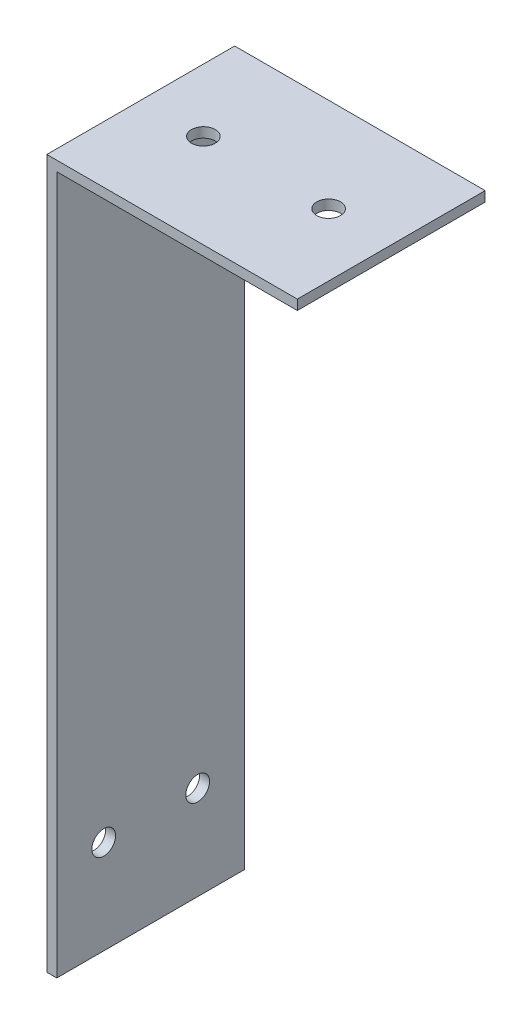
from build123d import *

# Parameters (mm, degrees)
BOSS_EXTRUDE1_DEPTH   = 15
F_6_CLEARANCE_HOLE1_D = 3.7973
F_6_CLEARANCE_HOLE2_D = 3.7973


with BuildPart() as part:
    # Sketch1 → Boss-Extrude1 (new, symmetric)
    with BuildSketch(Plane.XY):
        Polygon((0, 0), (0, 113.1), (40, 113.1), (40, 111.5125), (1.5875, 111.5125), (1.5875, 0), align=None)
    extrude(amount=BOSS_EXTRUDE1_DEPTH, both=True)

    # #6 Clearance Hole1 (through all)
    with Locations(Plane.ZY):
        with Locations((-7.5, 15), (7.5, 15)):
            Hole(F_6_CLEARANCE_HOLE1_D / 2)

    # #6 Clearance Hole2 (through all)
    with Locations(Plane(origin=(0, 113.1, 0), x_dir=(1, 0, 0), z_dir=(0, 1, 0))):
        with Locations((10, 0), (30, 0)):
            Hole(F_6_CLEARANCE_HOLE2_D / 2)


solid = part.part
